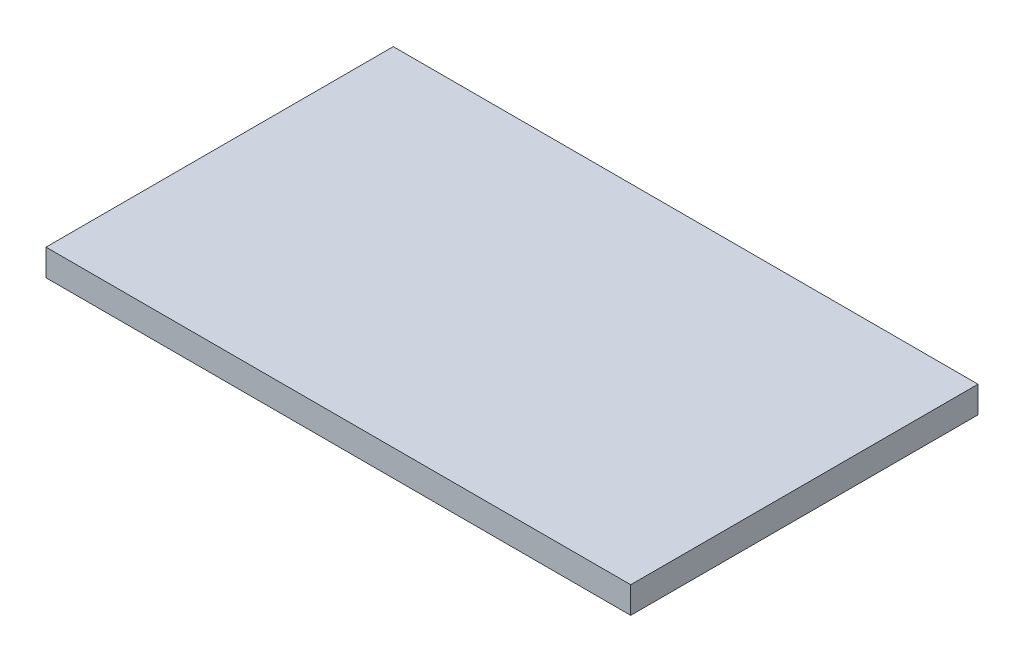
from build123d import *

# Parameters (mm, degrees)
SKETCH1_W              = 1277
SKETCH1_H              = 58
STORE_PU_TAVAN_1_DEPTH = 758.5


with BuildPart() as part:
    # Sketch1 → STORE_pu_tavan_1 (new body)
    with BuildSketch(Plane.XY):
        with Locations((700, 1640)):
            Rectangle(SKETCH1_W, SKETCH1_H)
    extrude(amount=-STORE_PU_TAVAN_1_DEPTH)


solid = part.part
